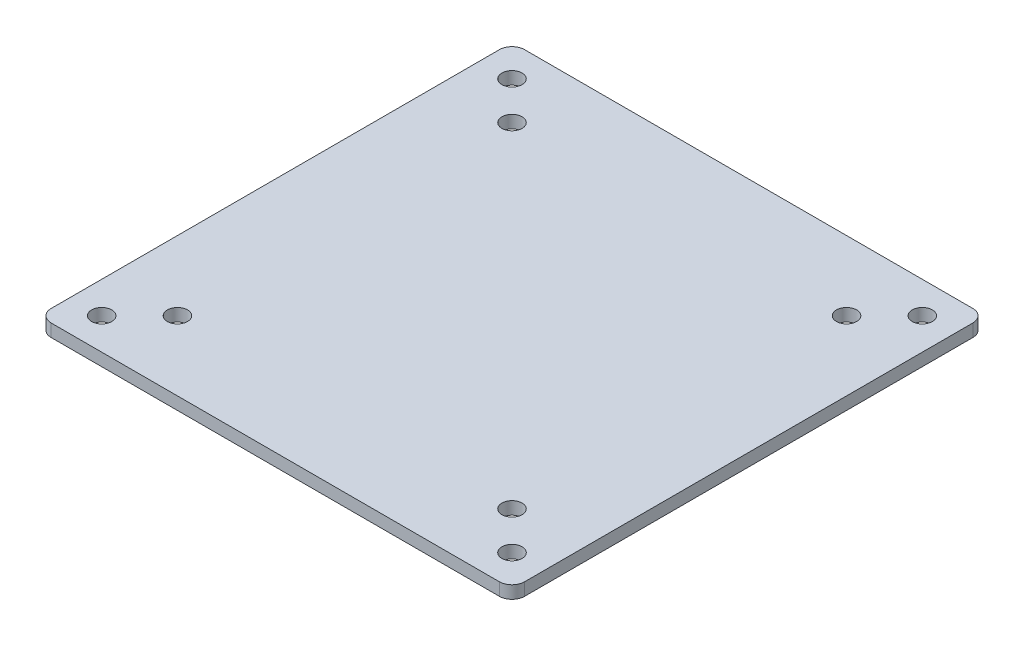
from build123d import *

# Parameters (mm, degrees)
SKETCH_1_W      = 75
SKETCH_1_H      = 75
SKETCH_1_R      = 1.6
EXTRUDE_1_DEPTH = 2
FILLET_1_R      = 2


with BuildPart() as part:
    # 草图1 → 凸台-拉伸1 (new body)
    with BuildSketch(Plane(origin=(0, 0, 0), x_dir=(1, 0, 0), z_dir=(0, 1, 0))):
        Rectangle(SKETCH_1_W, SKETCH_1_H)
        with Locations(Location((-26.5, 26.5, 0), (0, 0, 270))):
            Circle(SKETCH_1_R, mode=Mode.SUBTRACT)
        with Locations(Location((26.5, 26.5, 0), (0, 0, 270))):
            Circle(SKETCH_1_R, mode=Mode.SUBTRACT)
        with Locations(Location((26.5, -26.5, 0), (0, 0, 90))):
            Circle(SKETCH_1_R, mode=Mode.SUBTRACT)
        with Locations(Location((-26.5, -26.5, 0), (0, 0, 90))):
            Circle(SKETCH_1_R, mode=Mode.SUBTRACT)
        with Locations(Location((-32.5, 32.5, 0), (0, 0, 270))):
            Circle(SKETCH_1_R, mode=Mode.SUBTRACT)
        with Locations(Location((32.5, 32.5, 0), (0, 0, 270))):
            Circle(SKETCH_1_R, mode=Mode.SUBTRACT)
        with Locations(Location((32.5, -32.5, 0), (0, 0, 90))):
            Circle(SKETCH_1_R, mode=Mode.SUBTRACT)
        with Locations(Location((-32.5, -32.5, 0), (0, 0, 90))):
            Circle(SKETCH_1_R, mode=Mode.SUBTRACT)
    extrude(amount=EXTRUDE_1_DEPTH)

    # 圆角1
    fillet_1_edges = [part.edges().sort_by_distance(p)[0] for p in [
        (37.5, 1, 37.5),
        (-37.5, 1, 37.5),
        (-37.5, 1, -37.5),
        (37.5, 1, -37.5),
    ]]
    fillet(fillet_1_edges, radius=FILLET_1_R)


solid = part.part
